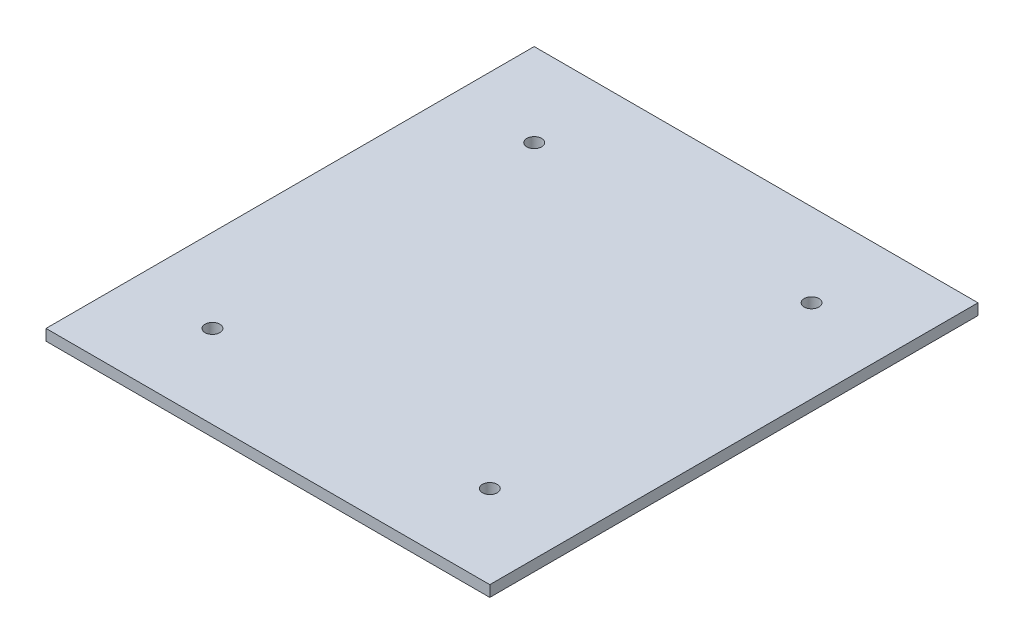
from build123d import *

# Parameters (mm, degrees)
SKETCH2_W           = 120
SKETCH2_H           = 132
SKETCH2_W_2         = 95
SKETCH2_H_2         = 107
SKETCH2_R           = 2
BOSS_EXTRUDE1_DEPTH = 3


with BuildPart() as part:
    # Sketch2 → Boss-Extrude1 (new body)
    # profile 1 of 3: a face of its own
    with BuildSketch(Plane(origin=(0, 0, 0), x_dir=(1, 0, 0), z_dir=(0, 1, 0))):
        Rectangle(SKETCH2_W, SKETCH2_H)
        Rectangle(SKETCH2_W_2, SKETCH2_H_2, mode=Mode.SUBTRACT)
    # profile 2 of 3: a face of its own
    with BuildSketch(Plane(origin=(0, 0, 0), x_dir=(1, 0, 0), z_dir=(0, 1, 0))):
        with BuildLine():
            ThreePointArc((37.5, -45.5), (36.085786438, -42.085786438), (39.5, -43.5))
            Line((39.5, -43.5), (47.5, -43.5))
            Line((47.5, -43.5), (47.5, 53.5))
            Line((47.5, 53.5), (-47.5, 53.5))
            Line((-47.5, 53.5), (-47.5, -53.5))
            Line((-47.5, -53.5), (37.5, -53.5))
            Line((37.5, -53.5), (37.5, -45.5))
        make_face()
        with Locations(Location((-37.5, -43.5, 0), (0, 0, 270))):
            Circle(SKETCH2_R, mode=Mode.SUBTRACT)
        with Locations(Location((-37.5, 43.5, 0), (0, 0, 270))):
            Circle(SKETCH2_R, mode=Mode.SUBTRACT)
        with Locations(Location((37.5, 43.5, 0), (0, 0, 270))):
            Circle(SKETCH2_R, mode=Mode.SUBTRACT)
    # profile 3 of 3: a face of its own
    with BuildSketch(Plane(origin=(0, 0, 0), x_dir=(1, 0, 0), z_dir=(0, 1, 0))):
        with BuildLine():
            Line((47.5, -43.5), (39.5, -43.5))
            ThreePointArc((39.5, -43.5), (38.914213562, -44.914213562), (37.5, -45.5))
            Line((37.5, -45.5), (37.5, -53.5))
            Line((37.5, -53.5), (47.5, -53.5))
            Line((47.5, -53.5), (47.5, -43.5))
        make_face()
    extrude(amount=BOSS_EXTRUDE1_DEPTH)


solid = part.part
